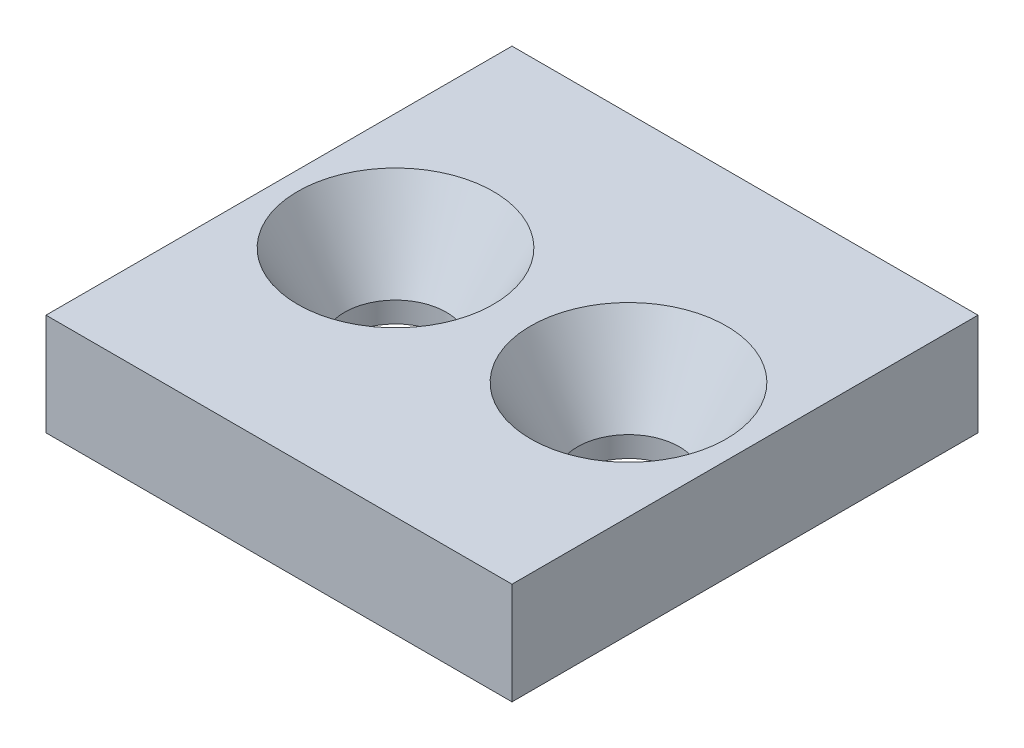
from build123d import *

# Parameters (mm, degrees)
SKETCH1_W                    = 32
SKETCH1_H                    = 32
BOSS_EXTRUDE1_DEPTH          = 7
CSK_FOR_M6_SFHCS1_AT_2_COUNT = 2
CSK_FOR_M6_SFHCS1_AT_2_PITCH = 16


with BuildPart() as part:
    # Sketch1 → Boss-Extrude1 (new body)
    with BuildSketch(Plane(origin=(0, 0, 0), x_dir=(1, 0, 0), z_dir=(0, 1, 0))):
        with Locations((16, 16)):
            Rectangle(SKETCH1_W, SKETCH1_H)
    extrude(amount=BOSS_EXTRUDE1_DEPTH)

    # Sketch4 → CSK for M6 SFHCS1 (revolve, cut)
    with BuildSketch(Plane(origin=(8, 7, -16), x_dir=(0, 0, 1), z_dir=(1, 0, 0))):
        Polygon((0, 0), (0, 7), (3.5, 7), (3.5, 5.5772036), (6.72, 0), align=None)
    csk_for_m6_sfhcs1 = revolve(axis=Axis((8, 13.35, -16), (0, -1, 0)), mode=Mode.SUBTRACT)

    # CSK for M6 SFHCS1 at 2: CSK for M6 SFHCS1 ×2
    with Locations(*[(i * CSK_FOR_M6_SFHCS1_AT_2_PITCH, 0, 0) for i in range(1, CSK_FOR_M6_SFHCS1_AT_2_COUNT)]):
        add(csk_for_m6_sfhcs1, mode=Mode.SUBTRACT)


solid = part.part
